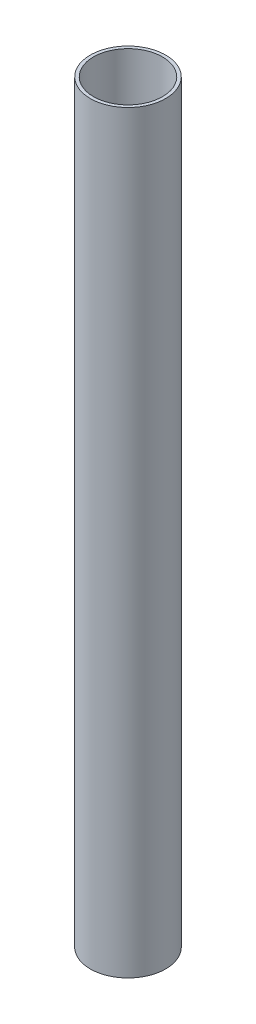
from build123d import *

# Parameters (mm, degrees)
SKETCH1_R           = 75
SKETCH1_R_2         = 68.65
BOSS_EXTRUDE1_DEPTH = 1500


with BuildPart() as part:
    # Sketch1 → Boss-Extrude1 (new body)
    with BuildSketch(Plane(origin=(0, 0, 0), x_dir=(1, 0, 0), z_dir=(0, 1, 0))):
        with Locations(Location((0, 0, 0), (0, 0, 270))):
            Circle(SKETCH1_R)
        with Locations(Location((0, 0, 0), (0, 0, 270))):
            Circle(SKETCH1_R_2, mode=Mode.SUBTRACT)
    extrude(amount=BOSS_EXTRUDE1_DEPTH)


solid = part.part
